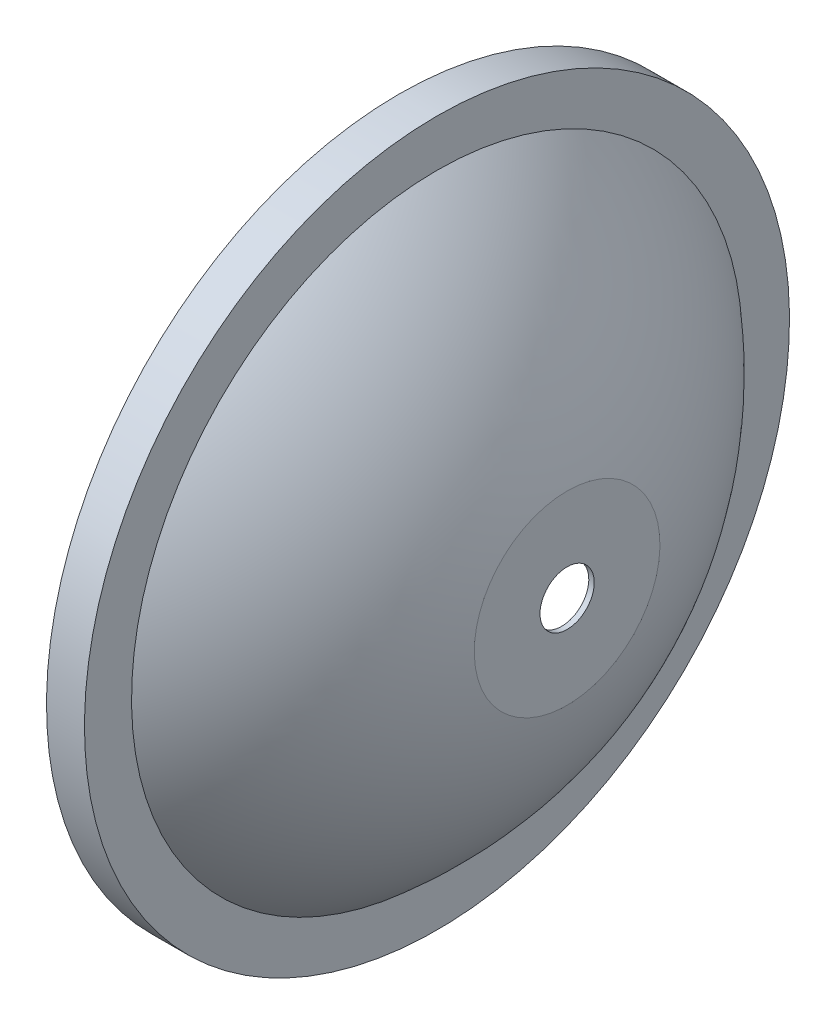
from build123d import *


with BuildPart() as part:
    # Sketch1 → Revolve1 (revolve)
    with BuildSketch(Plane.XY):
        with BuildLine():
            Line((0, 5), (0, 17))
            ThreePointArc((0, 17), (-8.879751576, 38.352961589), (-23.992957397, 55.856960175))
            Line((-23.992957397, 55.856960175), (-23.992957397, 64))
            Line((-23.992957397, 64), (-29.992957397, 64))
            Line((-29.992957397, 64), (-29.992957397, 65))
            Line((-29.992957397, 65), (-22.992957397, 65))
            Line((-22.992957397, 65), (-22.992957397, 56.320511361))
            ThreePointArc((-22.992957397, 56.320511361), (-7.875658194, 38.629089315), (1, 17.117654197))
            Line((1, 17.117654197), (1, 5))
            Line((1, 5), (0, 5))
        make_face()
    revolve(axis=Axis((36.017699115, 0, 0), (-1, 0, 0)))


solid = part.part
